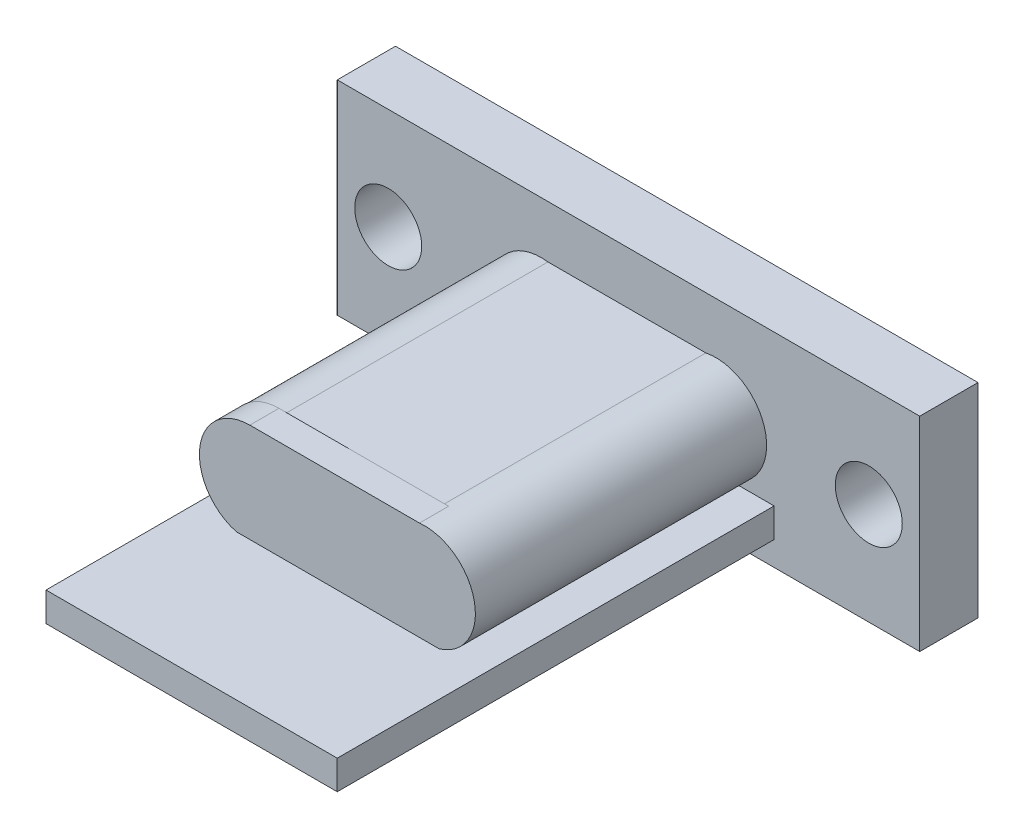
from build123d import *

# Parameters (mm, degrees)
SKETCH1_W            = 20
SKETCH1_H            = 7
SKETCH1_R            = 1.15
BOSS_EXTRUDE1_DEPTH  = 2
BOSS_EXTRUDE11_DEPTH = 10
BOSS_EXTRUDE12_DEPTH = 1
SKETCH8_W            = 10
SKETCH8_H            = 1
BOSS_EXTRUDE13_DEPTH = 5


with BuildPart() as part:
    # Sketch1 → Boss-Extrude1 (new body)
    with BuildSketch(Plane.XY):
        with Locations((10, 3.5)):
            Rectangle(SKETCH1_W, SKETCH1_H)
        with Locations((1.75, 3.5)):
            Circle(SKETCH1_R, mode=Mode.SUBTRACT)
        with Locations((18.25, 3.5)):
            Circle(SKETCH1_R, mode=Mode.SUBTRACT)
        with BuildLine():
            Line((7, 4.75), (13, 4.75))
            ThreePointArc((13, 4.75), (14.25, 3.5), (13, 2.25))
            Line((13, 2.25), (7, 2.25))
            ThreePointArc((7, 2.25), (5.75, 3.5), (7, 4.75))
        make_face(mode=Mode.SUBTRACT)
    extrude(amount=BOSS_EXTRUDE1_DEPTH)

    # Sketch6 → Boss-Extrude11 (add)
    with BuildSketch(Plane.XY.offset(2)):
        with BuildLine():
            Line((7.233144363, 5.202021214), (12.654721, 5.20752793))
            ThreePointArc((12.654721, 5.20752793), (14.690102928, 3.922399472), (13.498649888, 1.830803334))
            Line((13.498649888, 1.830803334), (15, 1.830803334))
            Line((15, 1.830803334), (15, 0.830803334))
            Line((15, 0.830803334), (5, 0.830803334))
            Line((5, 0.830803334), (5, 1.830803334))
            Line((5, 1.830803334), (6.593779621, 1.830803334))
            ThreePointArc((6.593779621, 1.830803334), (5.312171121, 3.820103391), (7.233144363, 5.202021214))
        make_face()
        with BuildLine():
            Line((7, 4.77), (13, 4.77))
            ThreePointArc((13, 4.77), (14.27, 3.5), (13, 2.23))
            Line((13, 2.23), (7, 2.23))
            ThreePointArc((7, 2.23), (5.73, 3.5), (7, 4.77))
        make_face(mode=Mode.SUBTRACT)
    extrude(amount=BOSS_EXTRUDE11_DEPTH)

    # Sketch7 → Boss-Extrude12 (add)
    with BuildSketch(Plane.XY.offset(12)):
        with BuildLine():
            Line((7, 5.233060679), (13, 5.233060679))
            ThreePointArc((13, 5.233060679), (14.733060679, 3.5), (13, 1.766939321))
            Line((13, 1.766939321), (7, 1.766939321))
            ThreePointArc((7, 1.766939321), (5.266939321, 3.5), (7, 5.233060679))
        make_face()
    extrude(amount=-BOSS_EXTRUDE12_DEPTH)

    # Sketch8 → Boss-Extrude13 (add)
    with BuildSketch(Plane.XY.offset(12)):
        with Locations((10, 1.330803334)):
            Rectangle(SKETCH8_W, SKETCH8_H)
    extrude(amount=BOSS_EXTRUDE13_DEPTH)


solid = part.part
